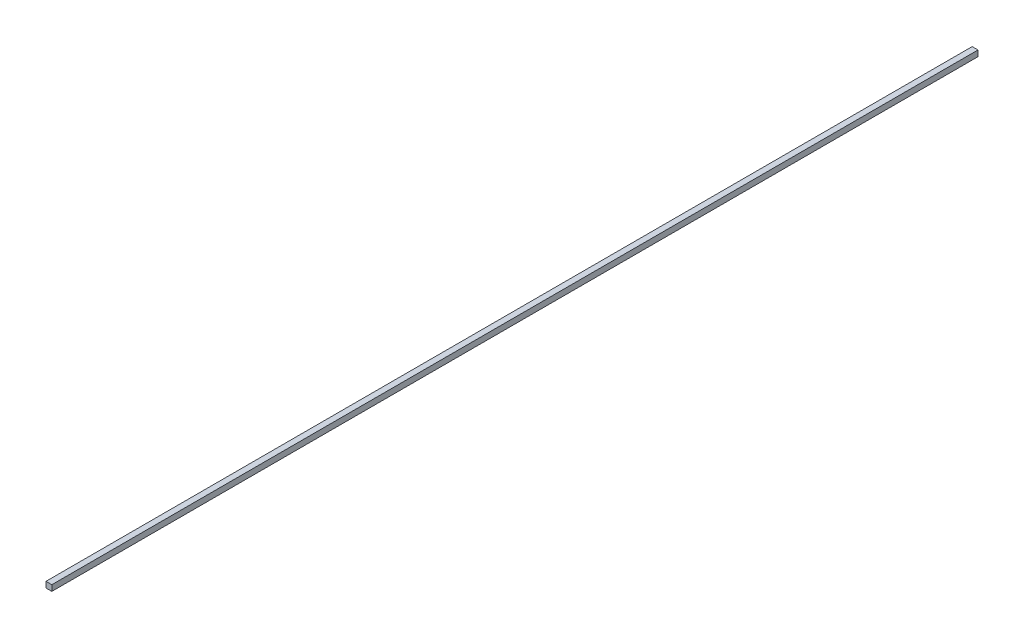
from build123d import *

# Parameters (mm, degrees)
SKETCH1_W           = 2
SKETCH1_H           = 2
BOSS_EXTRUDE1_DEPTH = 317.418847699


with BuildPart() as part:
    # Sketch1 → Boss-Extrude1 (new body)
    with BuildSketch(Plane.XY):
        Rectangle(SKETCH1_W, SKETCH1_H)
    extrude(amount=BOSS_EXTRUDE1_DEPTH)


solid = part.part
